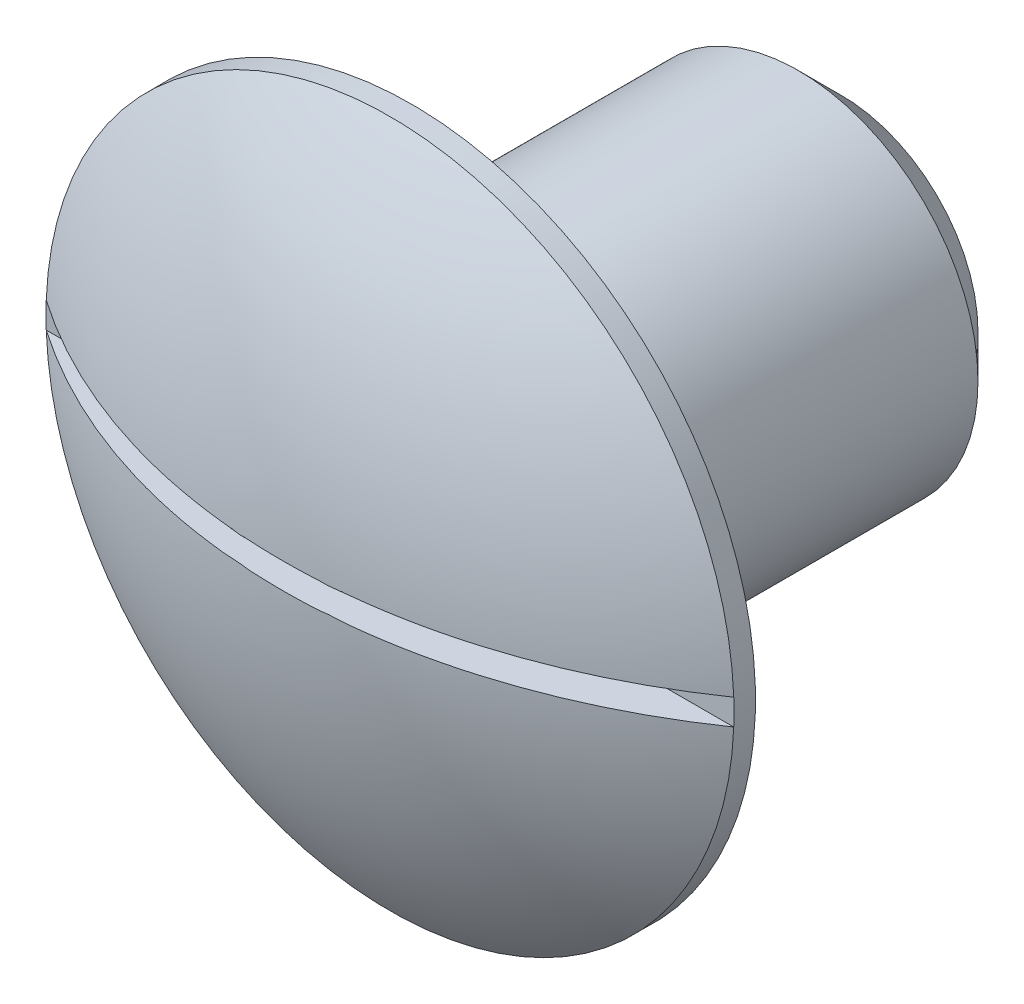
from build123d import *

# Parameters (mm, degrees)
SKETCH4_R               = 5.30225
BOSS_EXTRUDE3_DEPTH     = 12.7
CUT_EXTRUDE1_DEPTH      = 0.381
CUT_EXTRUDE1_DEPTH_BACK = 0.381
SKETCH6_W               = 20.32
SKETCH6_H               = 5.08
CHAMFER1_SIZE           = 1.27


with BuildPart() as part:
    # Sketch4 → Boss-Extrude3 (new body)
    with BuildSketch(Plane.XY):
        Circle(SKETCH4_R)
    extrude(amount=-BOSS_EXTRUDE3_DEPTH)

    # Sketch5 → Revolve2 (revolve)
    with BuildSketch(Plane(origin=(0, 0, 0), x_dir=(1, 0, 0), z_dir=(0, 1, 0)), mode=Mode.PRIVATE) as revolve2_sk:
        with BuildLine():
            Line((-10.16, 0), (-10.16, -0.635))
            ThreePointArc((-10.16, -0.635), (-5.32226984, -2.997763488), (0, -3.81))
            Line((0, -3.81), (0, 0))
            Line((0, 0), (-10.16, 0))
        make_face()
    revolve(revolve2_sk.sketch.rotate(Axis((0, 0, 0), (0, 0, 1)), 180), axis=Axis((0, 0, 0), (0, 0, 1)))

    # Sketch6 → Cut-Extrude1 (cut, two sides: drawn at the far end of the back side and taken through both)
    with BuildSketch(Plane(origin=(0, 0, 0), x_dir=(1, 0, 0), z_dir=(0, 1, 0)).offset(-CUT_EXTRUDE1_DEPTH_BACK)):
        with Locations((0, -3.175)):
            Rectangle(SKETCH6_W, SKETCH6_H)
    extrude(amount=CUT_EXTRUDE1_DEPTH + CUT_EXTRUDE1_DEPTH_BACK, mode=Mode.SUBTRACT)

    # Chamfer1
    chamfer1_edges = [part.edges().sort_by_distance(p)[0] for p in [
        (-5.30225, 0, -12.7),
    ]]
    chamfer(chamfer1_edges, length=CHAMFER1_SIZE)


solid = part.part
